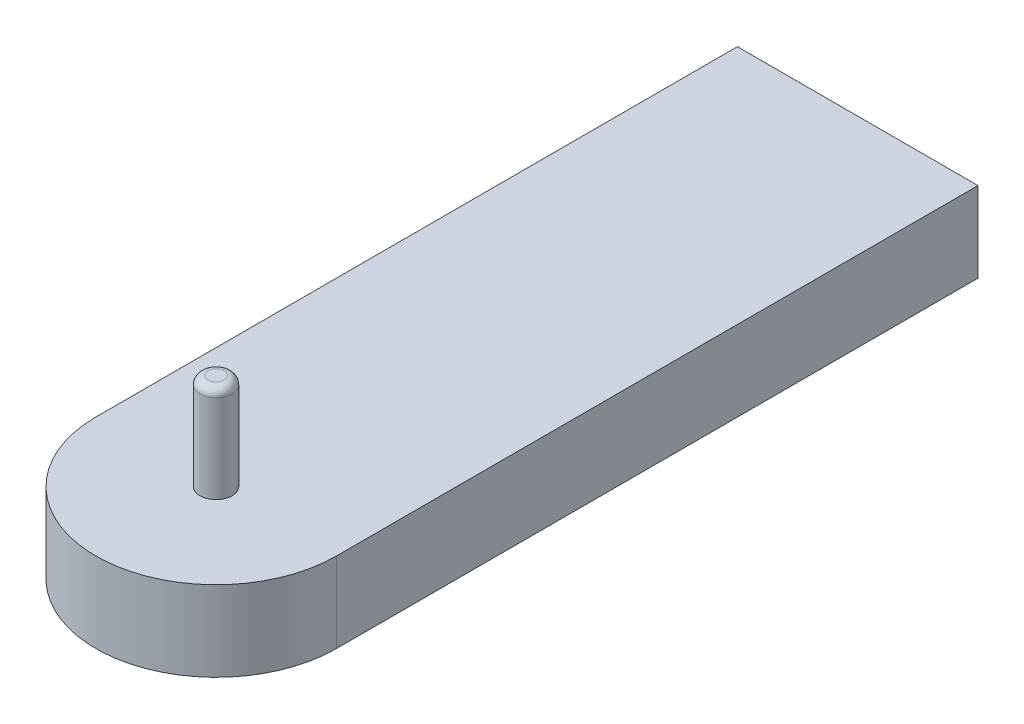
from build123d import *

# Parameters (mm, degrees)
EXTRUDE_1_DEPTH = 50
SKETCH_2_R      = 10
EXTRUDE_2_DEPTH = 60
FILLET_1_R      = 5


with BuildPart() as part:
    # 草图1 → 凸台-拉伸1 (new body)
    with BuildSketch(Plane(origin=(0, 0, 0), x_dir=(1, 0, 0), z_dir=(0, 1, 0))):
        with BuildLine():
            Line((0, 0), (150, 0))
            Line((150, 0), (150, -400))
            ThreePointArc((150, -400), (75, -475), (0, -400))
            Line((0, -400), (0, 0))
        make_face()
    extrude(amount=EXTRUDE_1_DEPTH)

    # 草图2 → 凸台-拉伸2 (add)
    with BuildSketch(Plane(origin=(0, 50, 0), x_dir=(1, 0, 0), z_dir=(0, 1, 0))):
        with Locations(Location((75, -400, 0), (0, 0, 270))):
            Circle(SKETCH_2_R)
    extrude(amount=EXTRUDE_2_DEPTH)

    # 圆角1
    fillet_1_edges = [part.edges().sort_by_distance(p)[0] for p in [
        (75, 110, 390),
    ]]
    fillet(fillet_1_edges, radius=FILLET_1_R)


solid = part.part
